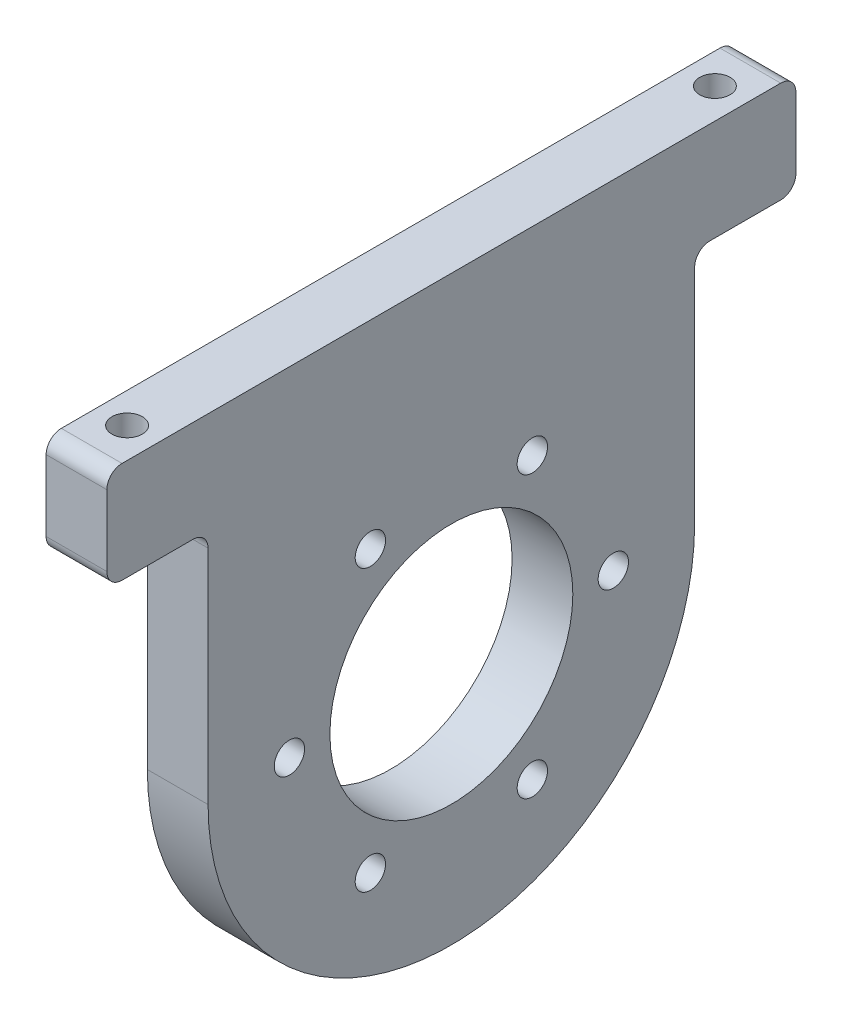
from build123d import *

# Parameters (mm, degrees)
SKETCH1_R           = 12
BOSS_EXTRUDE1_DEPTH = 6
CUT_EXTRUDE1_REACH  = 91.29
SKETCH2_R           = 1.5
CUT_EXTRUDE2_REACH  = 91.29
SKETCH3_R           = 1.5
FILLET1_R           = 1.5


with BuildPart() as part:
    # Sketch1 → Boss-Extrude1 (new body)
    with BuildSketch(Plane(origin=(0, 0, 0), x_dir=(0, 0, -1), z_dir=(1, 0, 0))):
        with BuildLine():
            Line((68.0694084, 0), (0, 0))
            Line((0, 0), (0, -10))
            Line((0, -10), (10, -10))
            Line((10, -10), (10, -33.439310345))
            ThreePointArc((10, -33.439310345), (34.0347042, -57.474014545), (58.0694084, -33.439310345))
            Line((58.0694084, -33.439310345), (58.0694084, -10))
            Line((58.0694084, -10), (68.0694084, -10))
            Line((68.0694084, -10), (68.0694084, 0))
        make_face()
        with Locations((34.0347042, -33.439310345)):
            Circle(SKETCH1_R, mode=Mode.SUBTRACT)
    extrude(amount=BOSS_EXTRUDE1_DEPTH)

    # Sketch2 → Cut-Extrude1 (cut, up to next)
    with BuildSketch(Plane(origin=(0, 0, 0), x_dir=(1, 0, 0), z_dir=(0, 1, 0)), mode=Mode.PRIVATE) as cut_extrude1_sk1:
        with Locations(Location((3, 63.0694084, 0), (0, 0, 270))):
            Circle(SKETCH2_R)
    cut_extrude1_tool1 = extrude(cut_extrude1_sk1.sketch, amount=-CUT_EXTRUDE1_REACH, mode=Mode.PRIVATE) & part.part
    # Sketch2 → Cut-Extrude1 (cut, up to next)
    with BuildSketch(Plane(origin=(0, 0, 0), x_dir=(1, 0, 0), z_dir=(0, 1, 0)), mode=Mode.PRIVATE) as cut_extrude1_sk2:
        with BuildLine():
            ThreePointArc((3.771743633, 6.286239389), (1.713760611, 5.771743633), (2.228256367, 3.713760611))
            Line((2.228256367, 3.713760611), (3.771743633, 6.286239389))
        make_face()
    cut_extrude1_tool2 = extrude(cut_extrude1_sk2.sketch, amount=-CUT_EXTRUDE1_REACH, mode=Mode.PRIVATE) & part.part
    # Sketch2 → Cut-Extrude1 (cut, up to next)
    with BuildSketch(Plane(origin=(0, 0, 0), x_dir=(1, 0, 0), z_dir=(0, 1, 0)), mode=Mode.PRIVATE) as cut_extrude1_sk3:
        with BuildLine():
            Line((3.771743633, 6.286239389), (2.228256367, 3.713760611))
            ThreePointArc((2.228256367, 3.713760611), (3.739048222, 3.69470014), (4.5, 5))
            ThreePointArc((4.5, 5), (4.30529986, 5.739048222), (3.771743633, 6.286239389))
        make_face()
    cut_extrude1_tool3 = extrude(cut_extrude1_sk3.sketch, amount=-CUT_EXTRUDE1_REACH, mode=Mode.PRIVATE) & part.part
    # Sketch2 → Cut-Extrude1 (cut, up to next)
    with BuildSketch(Plane(origin=(0, 0, 0), x_dir=(1, 0, 0), z_dir=(0, 1, 0)), mode=Mode.PRIVATE) as cut_extrude1_sk4:
        with BuildLine():
            ThreePointArc((3.771743633, 6.286239389), (1.713760611, 5.771743633), (2.228256367, 3.713760611))
            Line((2.228256367, 3.713760611), (3.771743633, 6.286239389))
        make_face()
    cut_extrude1_tool4 = extrude(cut_extrude1_sk4.sketch, amount=-CUT_EXTRUDE1_REACH, mode=Mode.PRIVATE) & part.part
    # Sketch2 → Cut-Extrude1 (cut, up to next)
    with BuildSketch(Plane(origin=(0, 0, 0), x_dir=(1, 0, 0), z_dir=(0, 1, 0)), mode=Mode.PRIVATE) as cut_extrude1_sk5:
        with BuildLine():
            Line((3.771743633, 6.286239389), (2.228256367, 3.713760611))
            ThreePointArc((2.228256367, 3.713760611), (3.739048222, 3.69470014), (4.5, 5))
            ThreePointArc((4.5, 5), (4.30529986, 5.739048222), (3.771743633, 6.286239389))
        make_face()
    cut_extrude1_tool5 = extrude(cut_extrude1_sk5.sketch, amount=-CUT_EXTRUDE1_REACH, mode=Mode.PRIVATE) & part.part
    add(cut_extrude1_tool1.solids().sort_by_distance((3, 0, -63.069408))[0], mode=Mode.SUBTRACT)
    add(cut_extrude1_tool2.solids().sort_by_distance((2.454103, 0, -5.327538))[0], mode=Mode.SUBTRACT)
    add(cut_extrude1_tool3.solids().sort_by_distance((3.545897, 0, -4.672462))[0], mode=Mode.SUBTRACT)
    add(cut_extrude1_tool4.solids().sort_by_distance((2.454103, 0, -5.327538))[0], mode=Mode.SUBTRACT)
    add(cut_extrude1_tool5.solids().sort_by_distance((3.545897, 0, -4.672462))[0], mode=Mode.SUBTRACT)

    # Sketch3 → Cut-Extrude2 (cut, up to next)
    with BuildSketch(Plane(origin=(0, 0, 0), x_dir=(0, 0, -1), z_dir=(1, 0, 0)), mode=Mode.PRIVATE) as cut_extrude2_sk1:
        with Locations((42.0347042, -47.295716805)):
            Circle(SKETCH3_R)
    cut_extrude2_tool1 = extrude(cut_extrude2_sk1.sketch, amount=CUT_EXTRUDE2_REACH, mode=Mode.PRIVATE) & part.part
    # Sketch3 → Cut-Extrude2 (cut, up to next)
    with BuildSketch(Plane(origin=(0, 0, 0), x_dir=(0, 0, -1), z_dir=(1, 0, 0)), mode=Mode.PRIVATE) as cut_extrude2_sk2:
        with Locations((50.0347042, -33.439310345)):
            Circle(SKETCH3_R)
    cut_extrude2_tool2 = extrude(cut_extrude2_sk2.sketch, amount=CUT_EXTRUDE2_REACH, mode=Mode.PRIVATE) & part.part
    # Sketch3 → Cut-Extrude2 (cut, up to next)
    with BuildSketch(Plane(origin=(0, 0, 0), x_dir=(0, 0, -1), z_dir=(1, 0, 0)), mode=Mode.PRIVATE) as cut_extrude2_sk3:
        with Locations((26.0347042, -19.582903884)):
            Circle(SKETCH3_R)
    cut_extrude2_tool3 = extrude(cut_extrude2_sk3.sketch, amount=CUT_EXTRUDE2_REACH, mode=Mode.PRIVATE) & part.part
    # Sketch3 → Cut-Extrude2 (cut, up to next)
    with BuildSketch(Plane(origin=(0, 0, 0), x_dir=(0, 0, -1), z_dir=(1, 0, 0)), mode=Mode.PRIVATE) as cut_extrude2_sk4:
        with Locations((18.0347042, -33.439310345)):
            Circle(SKETCH3_R)
    cut_extrude2_tool4 = extrude(cut_extrude2_sk4.sketch, amount=CUT_EXTRUDE2_REACH, mode=Mode.PRIVATE) & part.part
    # Sketch3 → Cut-Extrude2 (cut, up to next)
    with BuildSketch(Plane(origin=(0, 0, 0), x_dir=(0, 0, -1), z_dir=(1, 0, 0)), mode=Mode.PRIVATE) as cut_extrude2_sk5:
        with Locations((42.0347042, -19.582903884)):
            Circle(SKETCH3_R)
    cut_extrude2_tool5 = extrude(cut_extrude2_sk5.sketch, amount=CUT_EXTRUDE2_REACH, mode=Mode.PRIVATE) & part.part
    # Sketch3 → Cut-Extrude2 (cut, up to next)
    with BuildSketch(Plane(origin=(0, 0, 0), x_dir=(0, 0, -1), z_dir=(1, 0, 0)), mode=Mode.PRIVATE) as cut_extrude2_sk6:
        with Locations((26.0347042, -47.295716805)):
            Circle(SKETCH3_R)
    cut_extrude2_tool6 = extrude(cut_extrude2_sk6.sketch, amount=CUT_EXTRUDE2_REACH, mode=Mode.PRIVATE) & part.part
    add(cut_extrude2_tool1.solids().sort_by_distance((0, -47.295717, -42.034704))[0], mode=Mode.SUBTRACT)
    add(cut_extrude2_tool2.solids().sort_by_distance((0, -33.43931, -50.034704))[0], mode=Mode.SUBTRACT)
    add(cut_extrude2_tool3.solids().sort_by_distance((0, -19.582904, -26.034704))[0], mode=Mode.SUBTRACT)
    add(cut_extrude2_tool4.solids().sort_by_distance((0, -33.43931, -18.034704))[0], mode=Mode.SUBTRACT)
    add(cut_extrude2_tool5.solids().sort_by_distance((0, -19.582904, -42.034704))[0], mode=Mode.SUBTRACT)
    add(cut_extrude2_tool6.solids().sort_by_distance((0, -47.295717, -26.034704))[0], mode=Mode.SUBTRACT)

    # Fillet1
    fillet1_edges = [part.edges().sort_by_distance(p)[0] for p in [
        (3, 0, -68.0694084),
        (3, 0, 0),
        (3, -10, -68.0694084),
        (3, -10, 0),
        (3, -10, -58.0694084),
        (3, -10, -10),
    ]]
    fillet(fillet1_edges, radius=FILLET1_R)


solid = part.part
